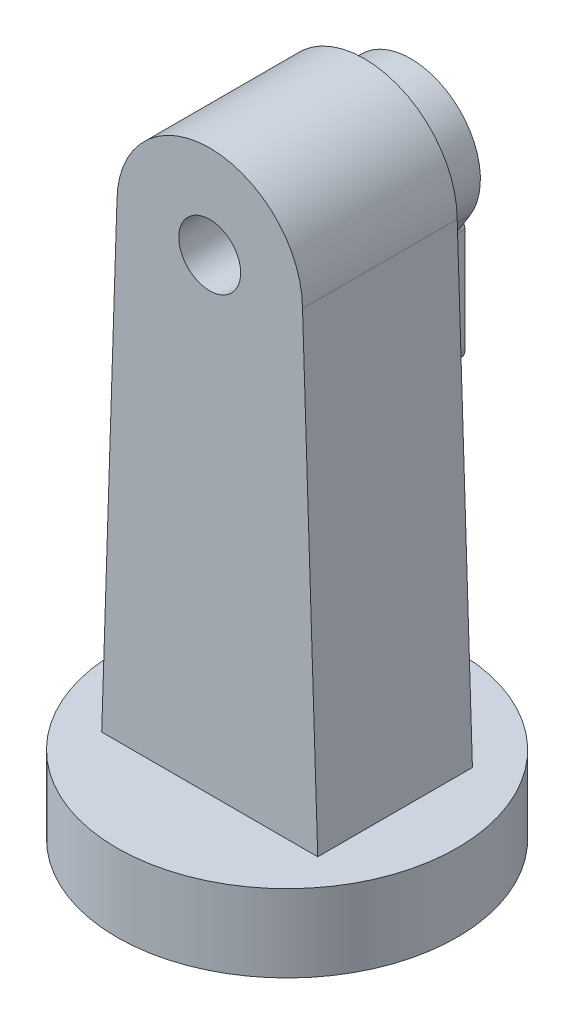
from build123d import *

# Parameters (mm, degrees)
ESQUISSE1_R             = 110
BOSS_EXTRU_1_DEPTH      = 50
BOSS_EXTRU_2_DEPTH      = 50
ESQUISSE3_R             = 20
ENL_V_MAT_EXTRU_1_DEPTH = 456.460206824
BOSS_EXTRU_3_DEPTH      = 30
BOSS_EXTRU_4_DEPTH      = 85


with BuildPart() as part:
    # Esquisse1 → Boss.-Extru.1 (new body)
    with BuildSketch(Plane(origin=(0, 0, 0), x_dir=(1, 0, 0), z_dir=(0, 1, 0))):
        Circle(ESQUISSE1_R)
    extrude(amount=BOSS_EXTRU_1_DEPTH)

    # Esquisse2 → Boss.-Extru.2 (add, symmetric)
    with BuildSketch(Plane.XY):
        with BuildLine():
            Line((-70, 45), (70, 45))
            Line((70, 45), (60, 352))
            ThreePointArc((60, 352), (0, 412), (-60, 352))
            Line((-60, 352), (-70, 45))
        make_face()
    extrude(amount=BOSS_EXTRU_2_DEPTH, both=True)

    # Esquisse3 → Enlèv. mat.-Extru.1 (cut, through all)
    with BuildSketch(Plane.XY.offset(50)):
        with Locations((0, 352)):
            Circle(ESQUISSE3_R)
    extrude(amount=-ENL_V_MAT_EXTRU_1_DEPTH, mode=Mode.SUBTRACT)

    # Esquisse4 → Boss.-Extru.3 (add)
    with BuildSketch(Plane(origin=(0, 0, -50), x_dir=(-1, 0, 0), z_dir=(0, 0, -1))):
        with BuildLine():
            Line((-38.056922747, 327.986032584), (56.171624225, 178.654251186))
            ThreePointArc((56.171624225, 178.654251186), (110.379680267, 165.580984438), (124.982074019, 219.397280669))
            Line((124.982074019, 219.397280669), (39.354833271, 373.821940753))
            ThreePointArc((39.354833271, 373.821940753), (-22.9271403, 390.721392507), (-38.056922747, 327.986032584))
        make_face()
    extrude(amount=BOSS_EXTRU_3_DEPTH)

    # Esquisse5 → Boss.-Extru.4 (add)
    with BuildSketch(Plane(origin=(0, 0, -80), x_dir=(-1, 0, 0), z_dir=(0, 0, -1))):
        with BuildLine():
            Line((56, 160), (124, 160))
            ThreePointArc((124, 160), (128.242640687, 161.757359313), (130, 166))
            Line((130, 166), (130, 234))
            ThreePointArc((130, 234), (128.242640687, 238.242640687), (124, 240))
            Line((124, 240), (56, 240))
            ThreePointArc((56, 240), (51.757359313, 238.242640687), (50, 234))
            Line((50, 234), (50, 166))
            ThreePointArc((50, 166), (51.757359313, 161.757359313), (56, 160))
        make_face()
    extrude(amount=BOSS_EXTRU_4_DEPTH)


solid = part.part
